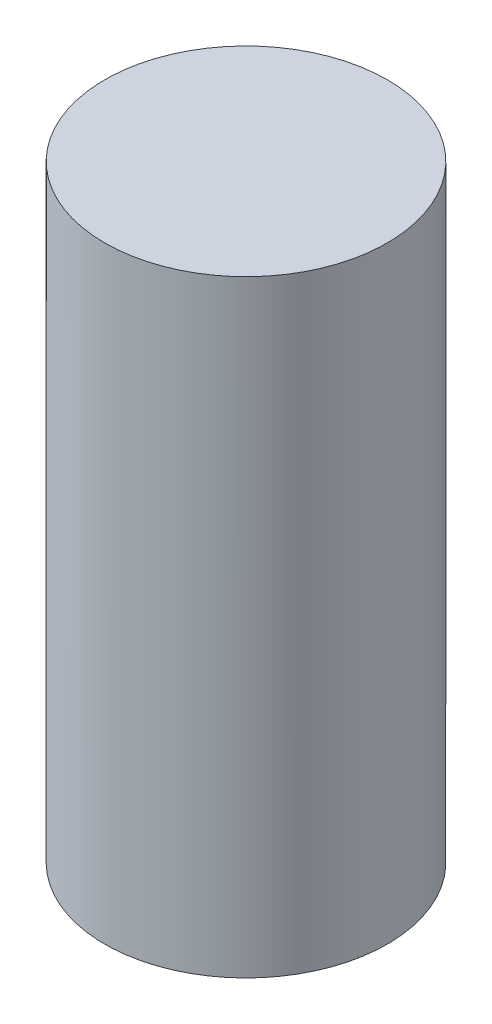
from build123d import *

# Parameters (mm, degrees)
ESQUISSE1_R        = 73.61
BOSS_EXTRU_1_DEPTH = 320
SKETCH2_W          = 28.172885559
SKETCH2_H          = 11.937663373


with BuildPart() as part:
    # Esquisse1 → Boss.-Extru.1 (new body)
    with BuildSketch(Plane(origin=(0, 0, 0), x_dir=(1, 0, 0), z_dir=(0, 1, 0))):
        with Locations(Location((0, 0, 0), (0, 0, 270))):
            Circle(ESQUISSE1_R)
    extrude(amount=BOSS_EXTRU_1_DEPTH)

    # Sketch2 → Cut-Revolve1 (revolve, cut)
    with BuildSketch(Plane.XY, mode=Mode.PRIVATE) as cut_revolve1_sk:
        with Locations((75.207279249, -2.35222187)):
            Rectangle(SKETCH2_W, SKETCH2_H)
    revolve(cut_revolve1_sk.sketch.rotate(Axis((0, 187.934132292, 0), (0, -1, 0)), 270), axis=Axis((0, 187.934132292, 0), (0, -1, 0)), mode=Mode.SUBTRACT)


solid = part.part
